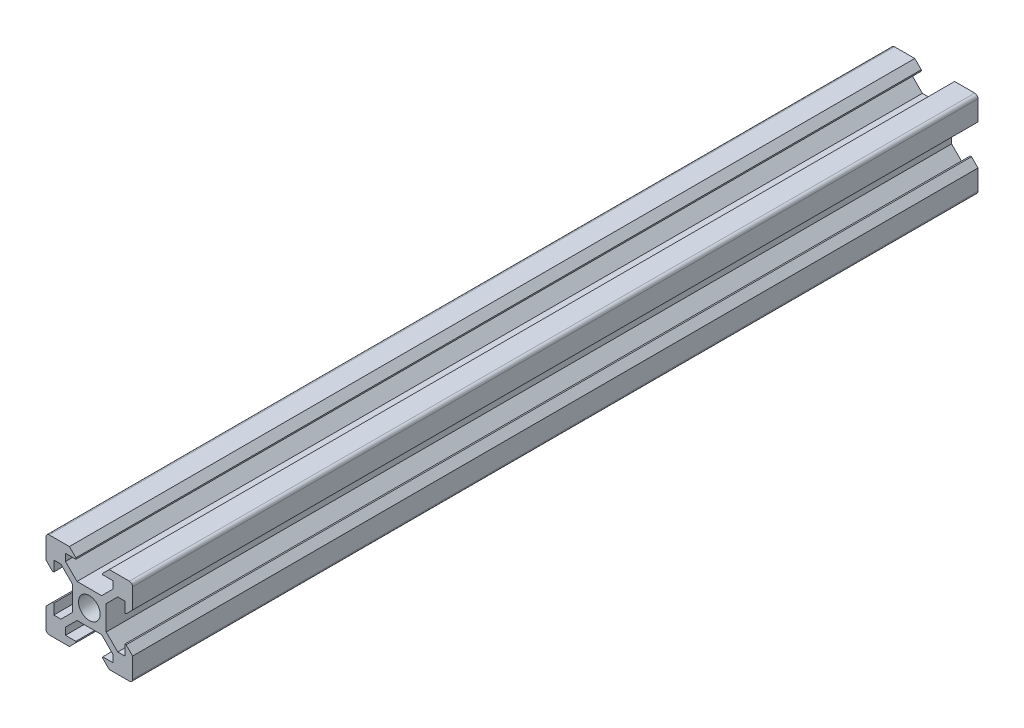
from build123d import *

# Parameters (mm, degrees)
CROQUIS1_R              = 2.5
SALIENTE_EXTRUIR1_DEPTH = 195.2


with BuildPart() as part:
    # Croquis1 → Saliente-Extruir1 (new body)
    with BuildSketch(Plane.XY):
        with BuildLine():
            Line((-4.6, 10), (-3.1, 8.5))
            Line((-3.1, 8.5), (-3.1, 8.2))
            Line((-3.1, 8.2), (-5.5, 8.2))
            Line((-5.5, 8.2), (-5.5, 6.560660172))
            Line((-5.5, 6.560660172), (-2.84, 3.900660172))
            Line((-2.84, 3.900660172), (0, 3.900660172))
            Line((0, 3.900660172), (2.84, 3.900660172))
            Line((2.84, 3.900660172), (5.5, 6.560660172))
            Line((5.5, 6.560660172), (5.5, 8.2))
            Line((5.5, 8.2), (3.1, 8.2))
            Line((3.1, 8.2), (3.1, 8.5))
            Line((3.1, 8.5), (4.6, 10))
            Line((4.6, 10), (9.25, 10))
            ThreePointArc((9.25, 10), (9.780330086, 9.780330086), (10, 9.25))
            Line((10, 9.25), (10, 4.6))
            Line((10, 4.6), (8.5, 3.1))
            Line((8.5, 3.1), (8.2, 3.1))
            Line((8.2, 3.1), (8.2, 5.5))
            Line((8.2, 5.5), (6.560660172, 5.5))
            Line((6.560660172, 5.5), (3.900660172, 2.84))
            Line((3.900660172, 2.84), (3.900660172, 0))
            Line((3.900660172, 0), (3.900660172, -2.84))
            Line((3.900660172, -2.84), (6.560660172, -5.5))
            Line((6.560660172, -5.5), (8.2, -5.5))
            Line((8.2, -5.5), (8.2, -3.1))
            Line((8.2, -3.1), (8.5, -3.1))
            Line((8.5, -3.1), (10, -4.6))
            Line((10, -4.6), (10, -9.25))
            ThreePointArc((10, -9.25), (9.780330086, -9.780330086), (9.25, -10))
            Line((9.25, -10), (4.6, -10))
            Line((4.6, -10), (3.1, -8.5))
            Line((3.1, -8.5), (3.1, -8.2))
            Line((3.1, -8.2), (5.5, -8.2))
            Line((5.5, -8.2), (5.5, -6.560660172))
            Line((5.5, -6.560660172), (2.84, -3.900660172))
            Line((2.84, -3.900660172), (0, -3.900660172))
            Line((0, -3.900660172), (-2.84, -3.900660172))
            Line((-2.84, -3.900660172), (-5.5, -6.560660172))
            Line((-5.5, -6.560660172), (-5.5, -8.2))
            Line((-5.5, -8.2), (-3.1, -8.2))
            Line((-3.1, -8.2), (-3.1, -8.5))
            Line((-3.1, -8.5), (-4.6, -10))
            Line((-4.6, -10), (-9.25, -10))
            ThreePointArc((-9.25, -10), (-9.780330086, -9.780330086), (-10, -9.25))
            Line((-10, -9.25), (-10, -4.6))
            Line((-10, -4.6), (-8.5, -3.1))
            Line((-8.5, -3.1), (-8.2, -3.1))
            Line((-8.2, -3.1), (-8.2, -5.5))
            Line((-8.2, -5.5), (-6.560660172, -5.5))
            Line((-6.560660172, -5.5), (-3.900660172, -2.84))
            Line((-3.900660172, -2.84), (-3.900660172, 0))
            Line((-3.900660172, 0), (-3.900660172, 2.84))
            Line((-3.900660172, 2.84), (-6.560660172, 5.5))
            Line((-6.560660172, 5.5), (-8.2, 5.5))
            Line((-8.2, 5.5), (-8.2, 3.1))
            Line((-8.2, 3.1), (-8.5, 3.1))
            Line((-8.5, 3.1), (-10, 4.6))
            Line((-10, 4.6), (-10, 9.25))
            ThreePointArc((-10, 9.25), (-9.780330086, 9.780330086), (-9.25, 10))
            Line((-9.25, 10), (-4.6, 10))
        make_face()
        Circle(CROQUIS1_R, mode=Mode.SUBTRACT)
    extrude(amount=SALIENTE_EXTRUIR1_DEPTH)


solid = part.part
